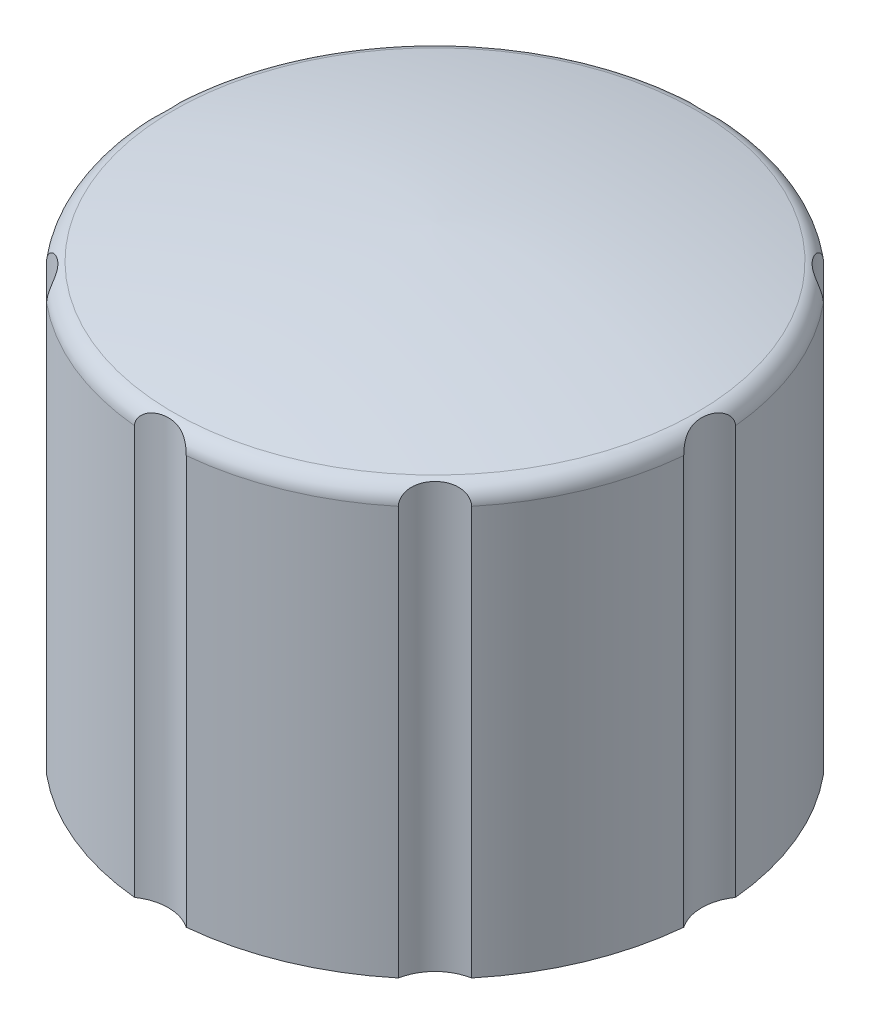
from build123d import *

# Parameters (mm, degrees)
FILLET1_R          = 1
SKETCH2_R          = 2.5
CUT_EXTRUDE1_DEPTH = 33.787192789


with BuildPart() as part:
    # Sketch1 → Revolve1 (revolve)
    with BuildSketch(Plane.XY, mode=Mode.PRIVATE) as revolve1_sk:
        with BuildLine():
            Line((-15, 19), (-15, -4))
            Line((-15, -4), (-12, -4))
            Line((-12, -4), (-12, 16))
            Line((-12, 16), (-5, 16))
            Line((-5, 16), (-5, 0))
            Line((-5, 0), (0, 0))
            Line((0, 0), (0, 21))
            ThreePointArc((0, 21), (-7.554204313, 20.406532346), (-15, 19))
        make_face()
    revolve(revolve1_sk.sketch.rotate(Axis((0, 0, 0), (0, 1, 0)), 270), axis=Axis((0, 0, 0), (0, 1, 0)))

    # Fillet1
    fillet1_edges = [part.edges().sort_by_distance(p)[0] for p in [
        (0, 19, 15),
    ]]
    fillet(fillet1_edges, radius=FILLET1_R)

    # Sketch2 → Cut-Extrude1 (cut, through all)
    with BuildSketch(Plane.XZ.offset(4)):
        with Locations((-17, 0)):
            Circle(SKETCH2_R)
        with Locations((-12.02081528, 12.02081528)):
            Circle(SKETCH2_R)
        with Locations((0, 17)):
            Circle(SKETCH2_R)
        with Locations((12.02081528, 12.02081528)):
            Circle(SKETCH2_R)
        with Locations((17, 0)):
            Circle(SKETCH2_R)
        with Locations((12.02081528, -12.02081528)):
            Circle(SKETCH2_R)
        with Locations((0, -17)):
            Circle(SKETCH2_R)
        with Locations((-12.02081528, -12.02081528)):
            Circle(SKETCH2_R)
    extrude(amount=-CUT_EXTRUDE1_DEPTH, mode=Mode.SUBTRACT)


solid = part.part
